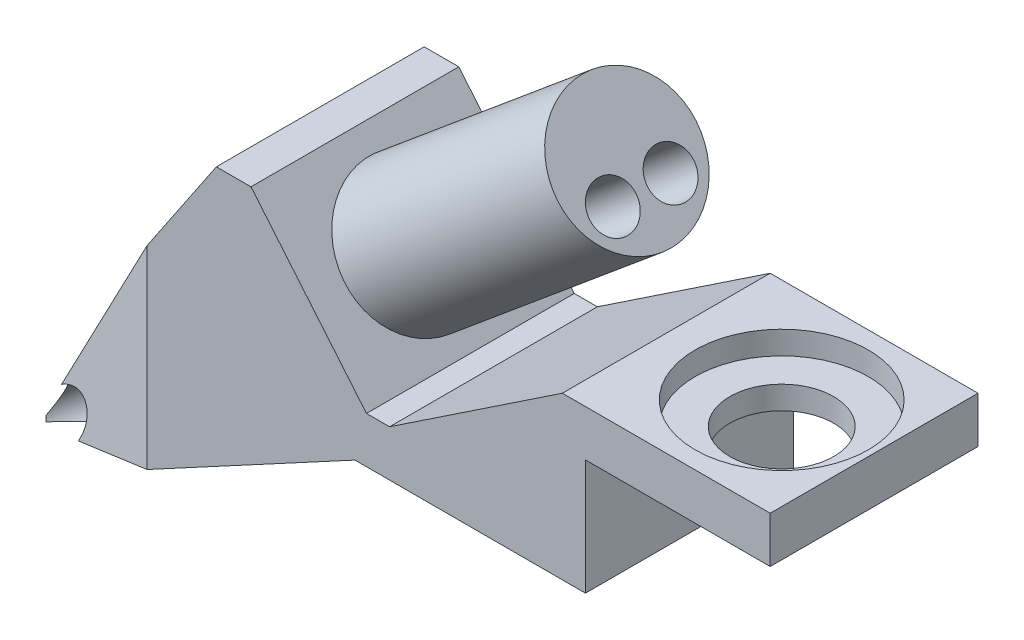
from build123d import *

# Parameters (mm, degrees)
BOSS_EXTRUDE1_DEPTH     = 9
SKETCH2_R               = 2.25
CUT_EXTRUDE1_DEPTH      = 16.5
SKETCH2_3_R             = 3.75
SKETCH2_3_R_2           = 2.25
CUT_EXTRUDE2_DEPTH      = 1
SKETCH3_R               = 3
BOSS_EXTRUDE2_DEPTH     = 12
CUT_EXTRUDE3_DEPTH      = 26.24364859
CUT_EXTRUDE3_DEPTH_BACK = 26.24364859
SKETCH4_R               = 1


with BuildPart() as part:
    # Sketch1 → Boss-Extrude1 (new body)
    with BuildSketch(Plane.XY):
        Polygon((0, 0), (17.616685226, 9.5), (27.6, 9.5), (27.6, 14.5), (35.6, 14.5), (35.6, 16.5), (26.6, 16.5), (19.116685226, 11.5), (18.116685226, 11.5), (13.116685226, 17.5), (11.616685226, 17.5), (0, 0.25), align=None)
    extrude(amount=BOSS_EXTRUDE1_DEPTH)

    # Sketch2 → Cut-Extrude1 (cut)
    with BuildSketch(Plane(origin=(0, 16.5, 0), x_dir=(1, 0, 0), z_dir=(0, 1, 0))):
        with Locations(Location((31.6, -4.5, 0), (0, 0, 270))):
            Circle(SKETCH2_R)
        Polygon((0, 0), (0, -4), (8.616685226, 0), align=None)
        Polygon((0, -5), (8.616685226, -9), (0, -9), align=None)
    extrude(amount=-CUT_EXTRUDE1_DEPTH, mode=Mode.SUBTRACT)

    # Sketch2<3> → Cut-Extrude2 (cut)
    with BuildSketch(Plane(origin=(0, 16.5, 0), x_dir=(1, 0, 0), z_dir=(0, 1, 0))):
        with Locations(Location((31.6, -4.5, 0), (0, 0, 270))):
            Circle(SKETCH2_3_R)
        with Locations(Location((31.6, -4.5, 0), (0, 0, 270))):
            Circle(SKETCH2_3_R_2, mode=Mode.SUBTRACT)
    extrude(amount=-CUT_EXTRUDE2_DEPTH, mode=Mode.SUBTRACT)

    # Sketch3 → Boss-Extrude2 (add)
    with BuildSketch(Plane(origin=(16.347551937, 13.622959947, 0), x_dir=(0, 0, -1), z_dir=(0.768221279597376, 0.6401843996644799, 0))):
        with Locations(Location((-4.5, 1.046775136, 0), (0, 0, 270))):
            Circle(SKETCH3_R)
    extrude(amount=BOSS_EXTRUDE2_DEPTH)

    # Sketch4 → Cut-Extrude3 (cut, two sides: drawn at the far end of the back side and taken through both)
    with BuildSketch(Plane(origin=(16.347551937, 13.622959947, 0), x_dir=(0, 0, -1), z_dir=(0.768221279597376, 0.6401843996644799, 0)).offset(-CUT_EXTRUDE3_DEPTH_BACK)):
        with Locations(Location((-5.75, 0.046775136, 0), (0, 0, 90))):
            Circle(SKETCH4_R)
        with Locations(Location((-3.25, 0.046775136, 0), (0, 0, 90))):
            Circle(SKETCH4_R)
    extrude(amount=CUT_EXTRUDE3_DEPTH + CUT_EXTRUDE3_DEPTH_BACK, mode=Mode.SUBTRACT)


solid = part.part
